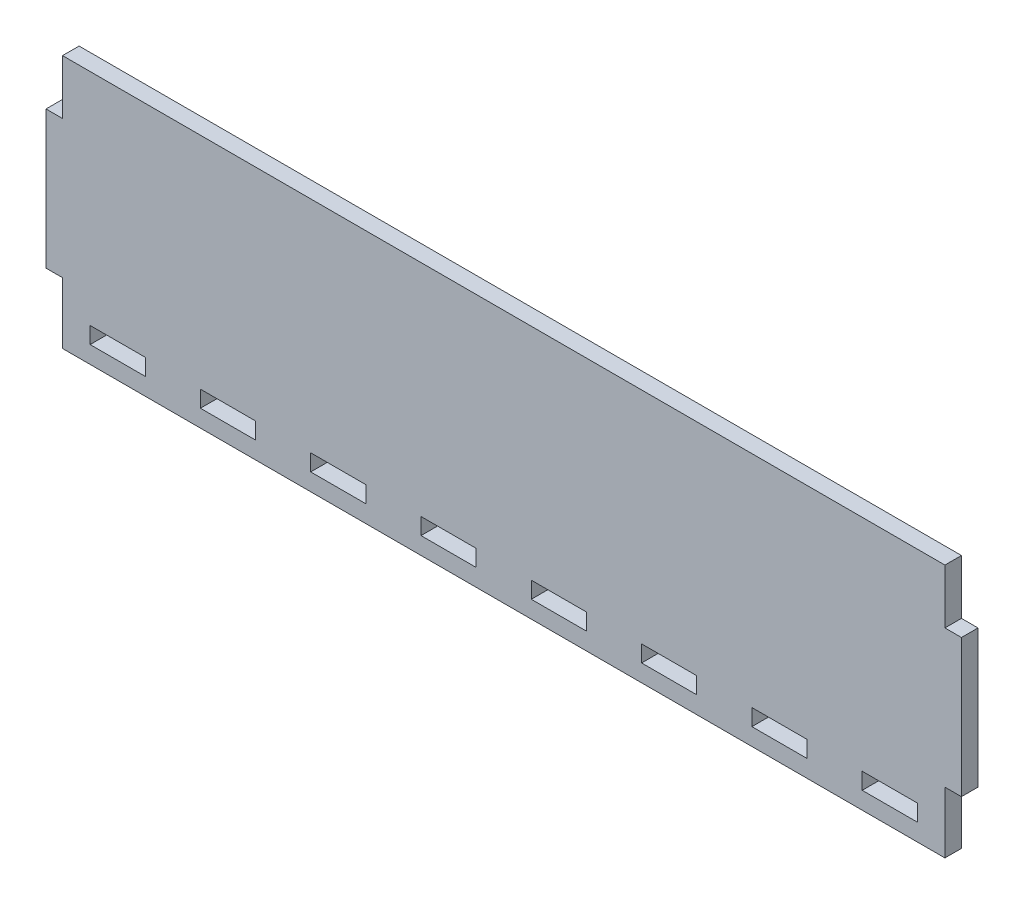
from build123d import *

# Parameters (mm, degrees)
SKETCH1_W           = 10
SKETCH1_H           = 3
BOSS_EXTRUDE1_DEPTH = 3


with BuildPart() as part:
    # Sketch1 → Boss-Extrude1 (new body)
    with BuildSketch(Plane.XY):
        Polygon((-31.361502347, 21.305164319), (128.638497653, 21.305164319), (128.638497653, 11.427031749), (131.638497653, 11.427031749), (131.638497653, -13.572968251), (128.638497653, -13.572968251), (128.638497653, -24.694835681), (-31.361502347, -24.694835681), (-31.361502347, -13.572968251), (-34.361502347, -13.572968251), (-34.361502347, 11.427031749), (-31.361502347, 11.427031749), align=None)
        with Locations((-1.361502347, -20.072968251)):
            Rectangle(SKETCH1_W, SKETCH1_H, mode=Mode.SUBTRACT)
        with Locations((-21.361502347, -20.072968251)):
            Rectangle(SKETCH1_W, SKETCH1_H, mode=Mode.SUBTRACT)
        with Locations((18.638497653, -20.072968251)):
            Rectangle(SKETCH1_W, SKETCH1_H, mode=Mode.SUBTRACT)
        with Locations((38.638497653, -20.072968251)):
            Rectangle(SKETCH1_W, SKETCH1_H, mode=Mode.SUBTRACT)
        with Locations((58.638497653, -20.072968251)):
            Rectangle(SKETCH1_W, SKETCH1_H, mode=Mode.SUBTRACT)
        with Locations((78.638497653, -20.072968251)):
            Rectangle(SKETCH1_W, SKETCH1_H, mode=Mode.SUBTRACT)
        with Locations((98.638497653, -20.072968251)):
            Rectangle(SKETCH1_W, SKETCH1_H, mode=Mode.SUBTRACT)
        with Locations((118.638497653, -20.072968251)):
            Rectangle(SKETCH1_W, SKETCH1_H, mode=Mode.SUBTRACT)
    extrude(amount=BOSS_EXTRUDE1_DEPTH)


solid = part.part
